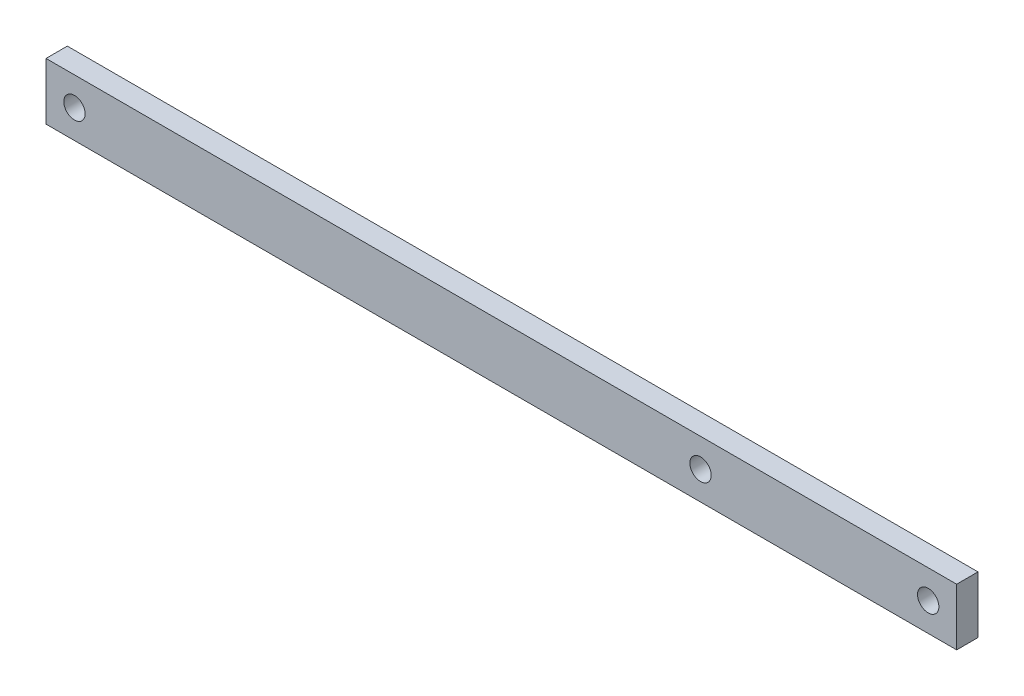
from build123d import *

# Parameters (mm, degrees)
SKETCH1_W           = 203.2
SKETCH1_H           = 12.7
SKETCH1_R           = 2.38125
BOSS_EXTRUDE1_DEPTH = 4.7625


with BuildPart() as part:
    # Sketch1 → Boss-Extrude1 (new body)
    with BuildSketch(Plane.XY):
        Rectangle(SKETCH1_W, SKETCH1_H)
        with Locations(Location((95.25, 0, 0), (0, 0, 180))):
            Circle(SKETCH1_R, mode=Mode.SUBTRACT)
        with Locations(Location((44.45, 0, 0), (0, 0, 180))):
            Circle(SKETCH1_R, mode=Mode.SUBTRACT)
        with Locations(Location((-95.25, 0, 0), (0, 0, 180))):
            Circle(SKETCH1_R, mode=Mode.SUBTRACT)
    extrude(amount=BOSS_EXTRUDE1_DEPTH)


solid = part.part
